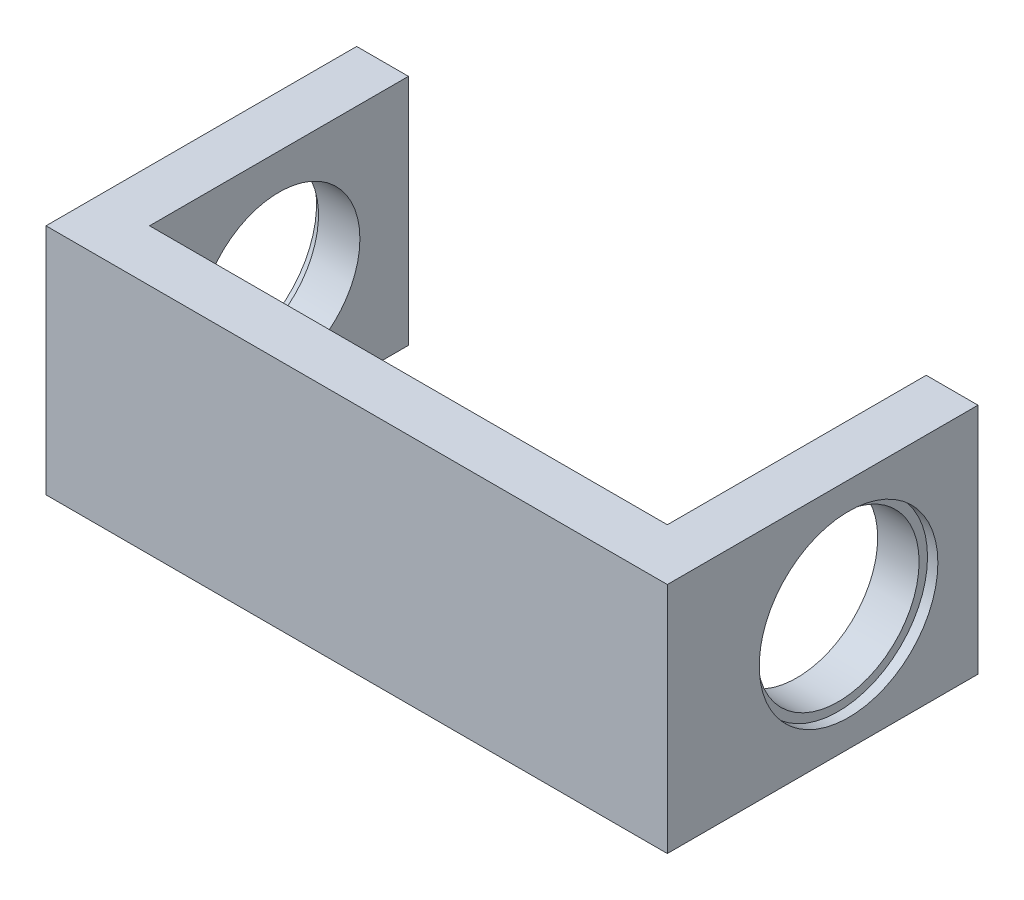
from build123d import *

# Parameters (mm, degrees)
EXTRUDE_THIN1_DEPTH                            = 22.86
CBORE_FOR_6_SOCKET_HEAD_CAP_SCREW1_D           = 15.875
CBORE_FOR_6_SOCKET_HEAD_CAP_SCREW1_DEPTH       = 5.08
CBORE_FOR_6_SOCKET_HEAD_CAP_SCREW1_CBORE_D     = 17.526
CBORE_FOR_6_SOCKET_HEAD_CAP_SCREW1_CBORE_DEPTH = 1.016
CBORE_FOR_6_SOCKET_HEAD_CAP_SCREW2_D           = 15.875
CBORE_FOR_6_SOCKET_HEAD_CAP_SCREW2_CBORE_D     = 17.526
CBORE_FOR_6_SOCKET_HEAD_CAP_SCREW2_CBORE_DEPTH = 1.016


with BuildPart() as part:
    # Sketch1 → Extrude-Thin1 (new body)
    with BuildSketch(Plane(origin=(0, 0, 0), x_dir=(1, 0, 0), z_dir=(0, 1, 0))):
        Polygon((0, 25.4), (0, 0), (50.8, 0), (50.8, 25.4), (55.88, 25.4), (55.88, -5.08), (-5.08, -5.08), (-5.08, 25.4), align=None)
    extrude(amount=EXTRUDE_THIN1_DEPTH)

    # CBORE for #6 Socket Head Cap Screw1
    with Locations(Plane(origin=(55.88, 0, 0), x_dir=(0, 0, -1), z_dir=(1, 0, 0))):
        with Locations((12.7, 11.43)):
            CounterBoreHole(CBORE_FOR_6_SOCKET_HEAD_CAP_SCREW1_D / 2, CBORE_FOR_6_SOCKET_HEAD_CAP_SCREW1_CBORE_D / 2, CBORE_FOR_6_SOCKET_HEAD_CAP_SCREW1_CBORE_DEPTH, depth=CBORE_FOR_6_SOCKET_HEAD_CAP_SCREW1_DEPTH)

    # CBORE for #6 Socket Head Cap Screw2 (through all)
    with Locations(Plane.ZY.offset(5.08)):
        with Locations((-12.7, 11.43)):
            CounterBoreHole(CBORE_FOR_6_SOCKET_HEAD_CAP_SCREW2_D / 2, CBORE_FOR_6_SOCKET_HEAD_CAP_SCREW2_CBORE_D / 2, CBORE_FOR_6_SOCKET_HEAD_CAP_SCREW2_CBORE_DEPTH)


solid = part.part
